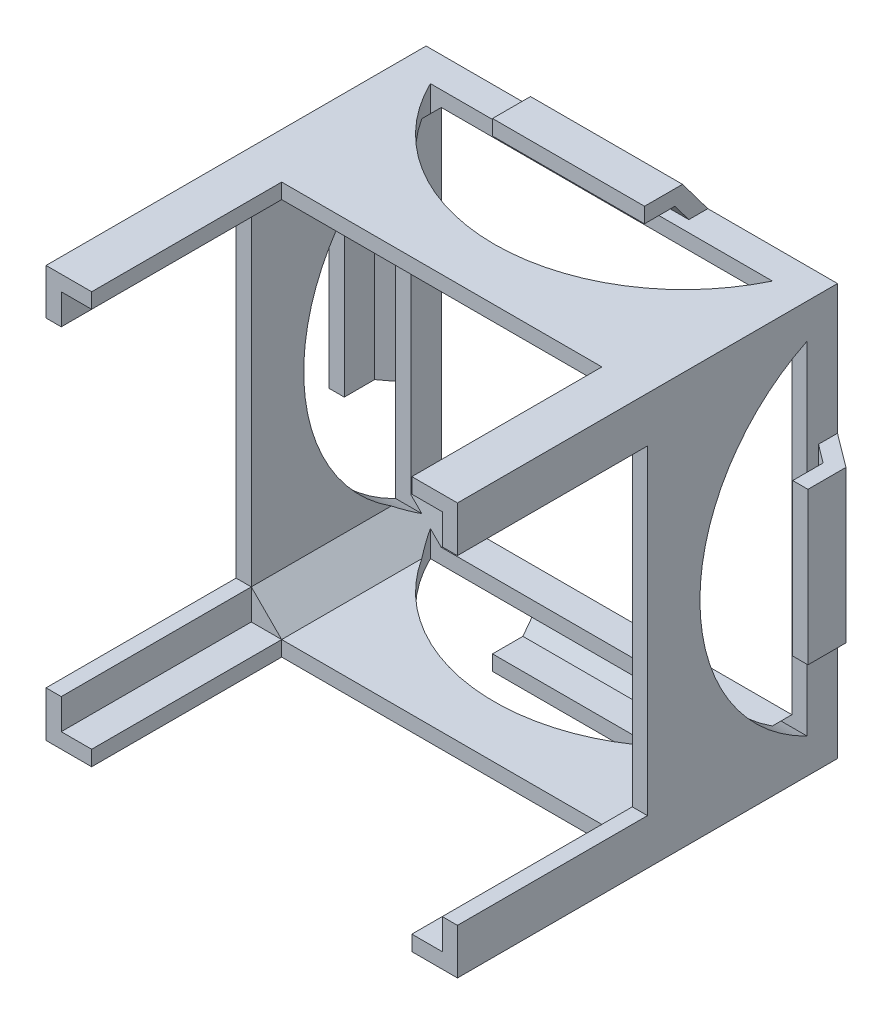
from build123d import *

# Parameters (mm, degrees)
SKETCH1_W                                    = 108.25
SKETCH1_H                                    = 108.25
SKETCH1_W_2                                  = 100.25
SKETCH1_H_2                                  = 100.25
BASE_DEPTH                                   = 50
CHAMFER_2_SIZE                               = 8
WALL_BRACE_DEPTH                             = 20
WALL_BRACE_PATTERN_COUNT                     = 4
LATTICE_SUPPORT_ARM_DEPTH                    = 50
LATTICE_SUPPORT_ARM_MIRROR_AT_THE_SE_3_DEPTH = 50
ARCHES_1_REACH                               = 168.395
ARCHES_2_REACH                               = 168.395


with BuildPart() as part:
    # Sketch1 → Base (new body)
    with BuildSketch(Plane.XY):
        Rectangle(SKETCH1_W, SKETCH1_H)
        Rectangle(SKETCH1_W_2, SKETCH1_H_2, mode=Mode.SUBTRACT)
    extrude(amount=BASE_DEPTH)

    # Chamfer 2
    chamfer_2_edges = [part.edges().sort_by_distance(p)[0] for p in [
        (50.125, -50.125, 25),
        (50.125, 50.125, 25),
        (-50.125, 50.125, 25),
        (-50.125, -50.125, 25),
    ]]
    chamfer(chamfer_2_edges, length=CHAMFER_2_SIZE)

    # Sketch3 → Wall-Brace (add, symmetric)
    with BuildSketch(Plane(origin=(0, 0, 0), x_dir=(1, 0, 0), z_dir=(0, 1, 0))):
        Polygon((54.125, 0), (63, -6.65625), (63, -16.65625), (59, -16.65625), (59, -8.65625), (54.125, -5), align=None)
    wall_brace = extrude(amount=WALL_BRACE_DEPTH, both=True)

    # Wall-Brace-Pattern: Wall-Brace ×4 about axis
    wall_brace_pattern_axis = Axis((0, 0, 0), (0, 0, 1))
    for i in range(1, WALL_BRACE_PATTERN_COUNT):
        add(wall_brace.rotate(wall_brace_pattern_axis, i * 360 / WALL_BRACE_PATTERN_COUNT))

    # Sketch4 → Lattice-Support-Arm (add)
    with BuildSketch(Plane.XY.offset(50)):
        Polygon((-50.125, 42.125), (-54.125, 42.125), (-54.125, 54.125), (-42.125, 54.125), (-42.125, 50.125), (-50.125, 50.125), align=None)
    lattice_support_arm = extrude(amount=LATTICE_SUPPORT_ARM_DEPTH)

    # Lattice-Support-Arm-Mirror: Lattice-Support-Arm across plane
    add(lattice_support_arm.mirror(Plane(origin=(0, 0, 0), x_dir=(0, 0, 1), z_dir=(1, 0, 0))))

    # Lattice-Support-Arm-Mirror at the second: Lattice-Support-Arm across plane
    add(lattice_support_arm.mirror(Plane.ZX))

    # Lattice-Support-Arm-Mirror at the se 2 → Lattice-Support-Arm-Mirror at the se 3 (add)
    with BuildSketch(Plane(origin=(0, 0, 50), x_dir=(-1, 0, 0), z_dir=(0, 0, 1))):
        Polygon((-50.125, 42.125), (-54.125, 42.125), (-54.125, 54.125), (-42.125, 54.125), (-42.125, 50.125), (-50.125, 50.125), align=None)
    extrude(amount=LATTICE_SUPPORT_ARM_MIRROR_AT_THE_SE_3_DEPTH)

    # Arches-1: up to this face of the body (flat: up to its plane)
    arches_1_end = Plane(part.part.faces().sort_by_distance((-54.125, 0, 35.058479532))[0])
    # Sketch5 → Arches-1 (cut, up to the picked face)
    with BuildSketch(Plane.ZY.offset(-54.125), mode=Mode.PRIVATE) as arches_1_sk1:
        with BuildLine():
            Line((8, 45), (8, -45))
            ThreePointArc((8, -45), (36.205505282, 0), (8, 45))
        make_face()
    arches_1_tool1 = split(extrude(arches_1_sk1.sketch, amount=ARCHES_1_REACH, mode=Mode.PRIVATE), bisect_by=arches_1_end, keep=Keep.BOTH, mode=Mode.PRIVATE)
    add(arches_1_tool1.solids().sort_by(Axis((54.125, 0, 19.609008), (-1, 0, 0)))[0], mode=Mode.SUBTRACT)

    # Arches-2: up to this face of the body (flat: up to its plane)
    arches_2_end = Plane(part.part.faces().sort_by_distance((0, -54.125, 35.058479532))[0])
    # Sketch6 → Arches-2 (cut, up to the picked face)
    with BuildSketch(Plane(origin=(0, 54.125, 0), x_dir=(1, 0, 0), z_dir=(0, 1, 0)), mode=Mode.PRIVATE) as arches_2_sk1:
        with BuildLine():
            Line((-45, -8), (45, -8))
            ThreePointArc((45, -8), (0, -36.205505282), (-45, -8))
        make_face()
    arches_2_tool1 = split(extrude(arches_2_sk1.sketch, amount=-ARCHES_2_REACH, mode=Mode.PRIVATE), bisect_by=arches_2_end, keep=Keep.BOTH, mode=Mode.PRIVATE)
    add(arches_2_tool1.solids().sort_by(Axis((0, 54.125, 19.609008), (0, -1, 0)))[0], mode=Mode.SUBTRACT)


solid = part.part
